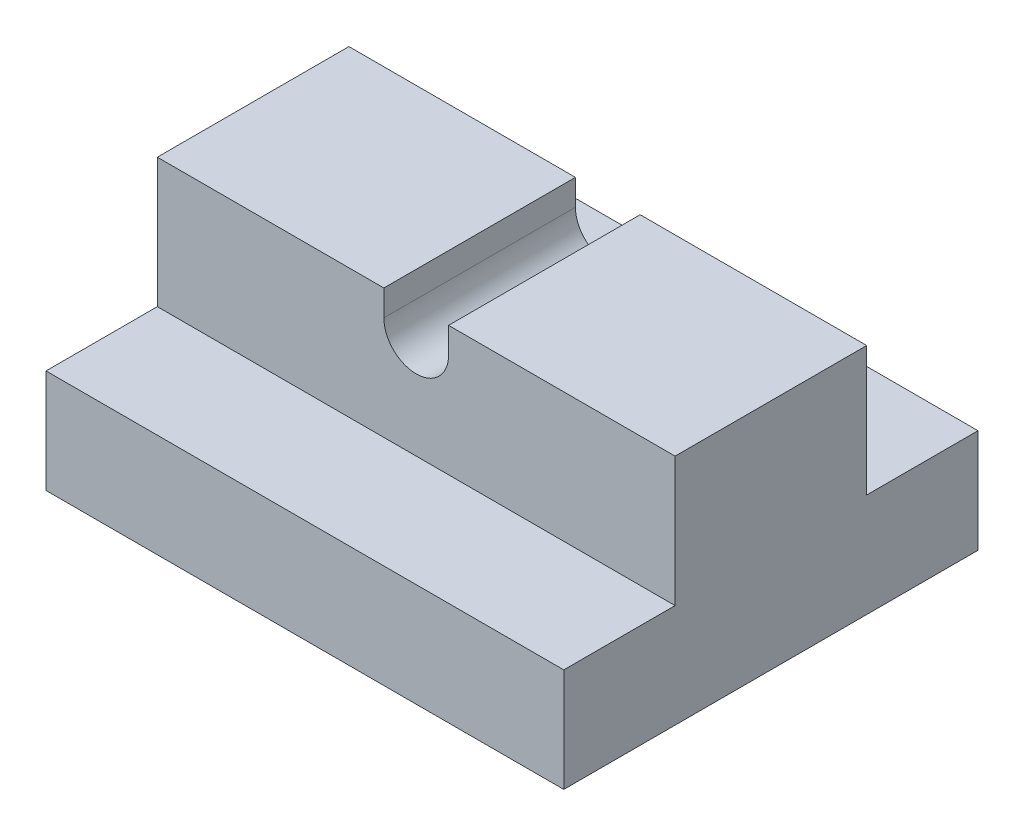
from build123d import *

# Parameters (mm, degrees)
SKETCH1_W           = 10
SKETCH1_H           = 8
BOSS_EXTRUDE1_DEPTH = 2
SKETCH2_W           = 10
SKETCH2_H           = 3.7
BOSS_EXTRUDE2_DEPTH = 2.5
CUT_EXTRUDE1_REACH  = 10.915


with BuildPart() as part:
    # Sketch1 → Boss-Extrude1 (new body)
    with BuildSketch(Plane(origin=(0, 0, 0), x_dir=(1, 0, 0), z_dir=(0, 1, 0))):
        Rectangle(SKETCH1_W, SKETCH1_H)
    extrude(amount=BOSS_EXTRUDE1_DEPTH)

    # Sketch2 → Boss-Extrude2 (add)
    with BuildSketch(Plane(origin=(0, 2, 0), x_dir=(1, 0, 0), z_dir=(0, 1, 0))):
        Rectangle(SKETCH2_W, SKETCH2_H)
    extrude(amount=BOSS_EXTRUDE2_DEPTH)

    # Sketch3 → Cut-Extrude1 (cut, up to next)
    with BuildSketch(Plane.XY.offset(1.85), mode=Mode.PRIVATE) as cut_extrude1_sk1:
        with BuildLine():
            Line((-0.625, 4), (-0.625, 4.5))
            Line((-0.625, 4.5), (0.625, 4.5))
            Line((0.625, 4.5), (0.625, 4))
            ThreePointArc((0.625, 4), (0, 3.375), (-0.625, 4))
        make_face()
    cut_extrude1_tool1 = extrude(cut_extrude1_sk1.sketch, amount=-CUT_EXTRUDE1_REACH, mode=Mode.PRIVATE) & part.part
    add(cut_extrude1_tool1.solids().sort_by_distance((0, 3.994744, 1.85))[0], mode=Mode.SUBTRACT)


solid = part.part
